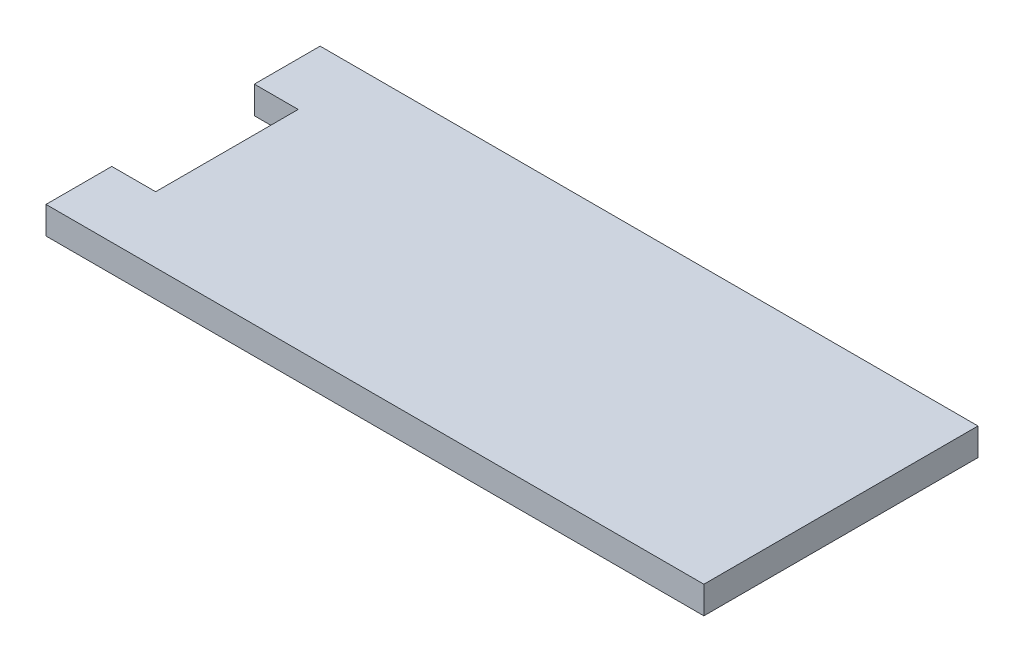
from build123d import *

# Parameters (mm, degrees)
SKETCH1_W           = 76.2
SKETCH1_H           = 31.75
BOSS_EXTRUDE1_DEPTH = 3.175
SKETCH2_W           = 5.08
SKETCH2_H           = 16.51
CUT_EXTRUDE1_DEPTH  = 3.175


with BuildPart() as part:
    # Sketch1 → Boss-Extrude1 (new body)
    with BuildSketch(Plane(origin=(0, 0, 0), x_dir=(1, 0, 0), z_dir=(0, 1, 0))):
        Rectangle(SKETCH1_W, SKETCH1_H)
    extrude(amount=BOSS_EXTRUDE1_DEPTH)

    # Sketch2 → Cut-Extrude1 (cut)
    with BuildSketch(Plane(origin=(0, 3.175, 0), x_dir=(1, 0, 0), z_dir=(0, 1, 0))):
        with Locations((-35.56, 0)):
            Rectangle(SKETCH2_W, SKETCH2_H)
    extrude(amount=-CUT_EXTRUDE1_DEPTH, mode=Mode.SUBTRACT)


solid = part.part
